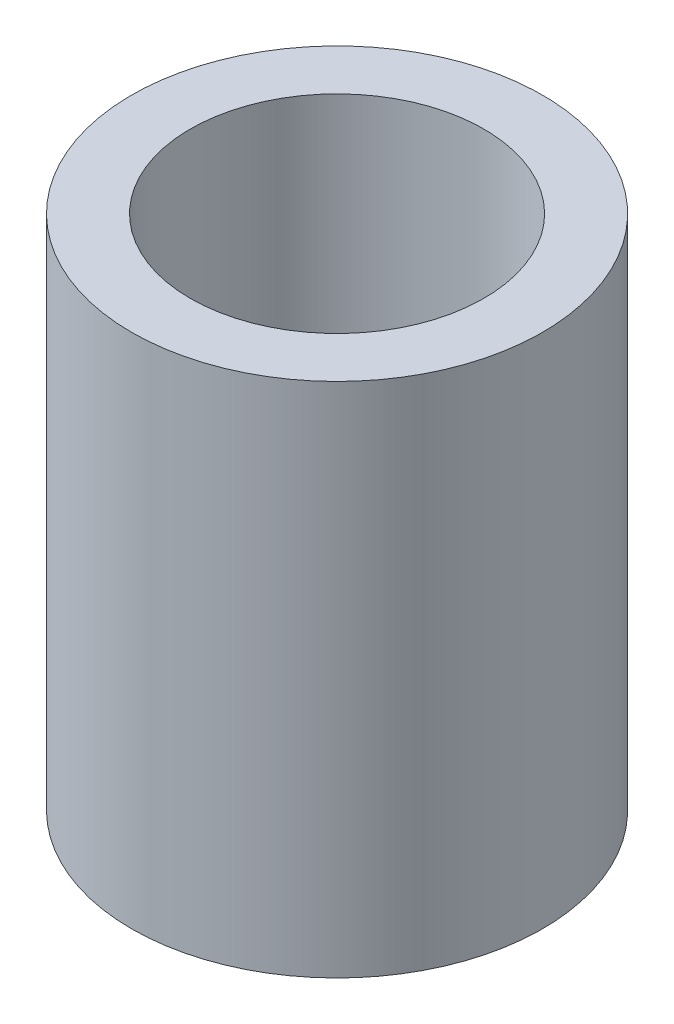
from build123d import *

# Parameters (mm, degrees)
SKETCH1_R           = 5.55625
SKETCH1_R_2         = 3.96875
BOSS_EXTRUDE1_DEPTH = 13.97


with BuildPart() as part:
    # Sketch1 → Boss-Extrude1 (new body)
    with BuildSketch(Plane(origin=(0, 0, 0), x_dir=(1, 0, 0), z_dir=(0, 1, 0))):
        with Locations(Location((0, 0, 0), (0, 0, 270))):
            Circle(SKETCH1_R)
        with Locations(Location((0, 0, 0), (0, 0, 270))):
            Circle(SKETCH1_R_2, mode=Mode.SUBTRACT)
    extrude(amount=-BOSS_EXTRUDE1_DEPTH)


solid = part.part
